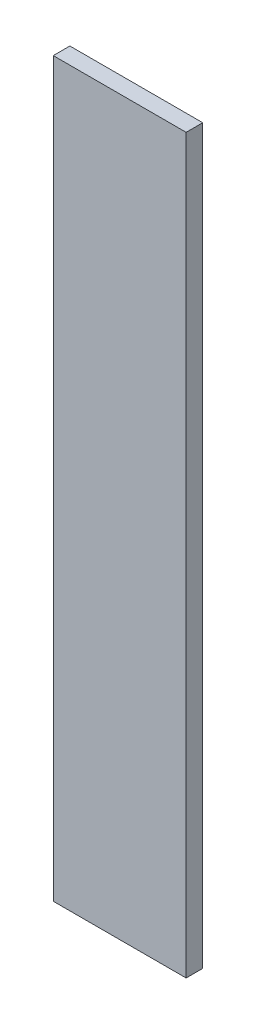
from build123d import *

# Parameters (mm, degrees)
SKETCH1_W           = 25.4
SKETCH1_H           = 140
BOSS_EXTRUDE1_DEPTH = 3.175


with BuildPart() as part:
    # Sketch1 → Boss-Extrude1 (new body)
    with BuildSketch(Plane.XY):
        with Locations((12.7, 70)):
            Rectangle(SKETCH1_W, SKETCH1_H)
    extrude(amount=BOSS_EXTRUDE1_DEPTH)


solid = part.part
